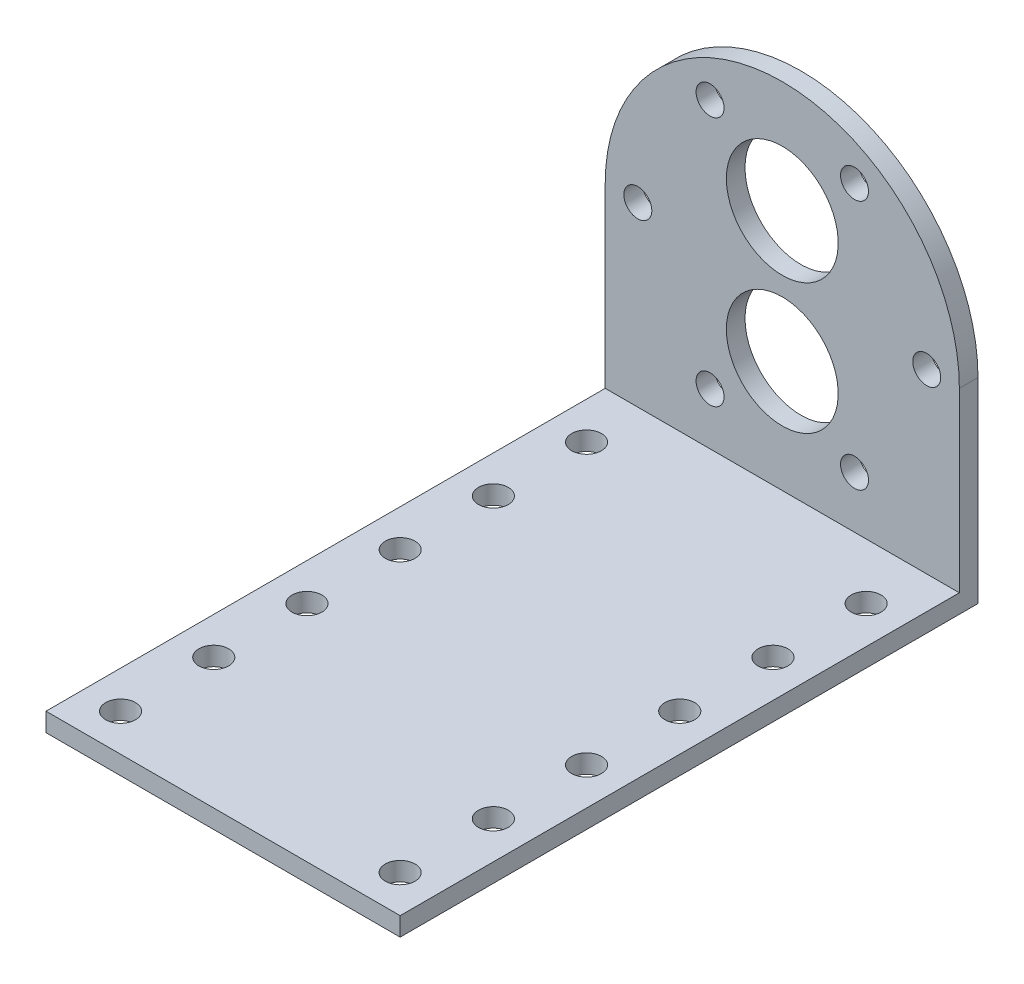
from build123d import *

# Parameters (mm, degrees)
EXTRUDE_1_DEPTH     = 2
SKETCH_2_W          = 38
SKETCH_2_H          = 2
EXTRUDE_2_DEPTH     = 60
SKETCH_3_R          = 1.6
CUT_EXTRUDE_1_DEPTH = 2
SKETCH_4_R          = 6
SKETCH_4_R_2        = 1.5
CUT_EXTRUDE_3_DEPTH = 2


with BuildPart() as part:
    # ｽｹｯﾁ1 → ﾎﾞｽ - 押し出し1 (new body)
    with BuildSketch(Plane.XY):
        with BuildLine():
            Line((-19, 0), (-19, -21))
            Line((-19, -21), (19, -21))
            Line((19, -21), (19, 0))
            ThreePointArc((19, 0), (0, 19), (-19, 0))
        make_face()
    extrude(amount=EXTRUDE_1_DEPTH)

    # ｽｹｯﾁ2 → ﾎﾞｽ - 押し出し2 (add)
    with BuildSketch(Plane.XY.offset(2)):
        with Locations((0, -20)):
            Rectangle(SKETCH_2_W, SKETCH_2_H)
    extrude(amount=EXTRUDE_2_DEPTH)

    # ｽｹｯﾁ3 → ｶｯﾄ - 押し出し1 (cut)
    with BuildSketch(Plane(origin=(0, -19, 0), x_dir=(1, 0, 0), z_dir=(0, 1, 0))):
        with Locations(Location((-15, -8, 0), (0, 0, 270))):
            Circle(SKETCH_3_R)
        with Locations(Location((-15, -18, 0), (0, 0, 270))):
            Circle(SKETCH_3_R)
        with Locations(Location((-15, -38, 0), (0, 0, 270))):
            Circle(SKETCH_3_R)
        with Locations(Location((-15, -28, 0), (0, 0, 270))):
            Circle(SKETCH_3_R)
        with Locations(Location((-15, -48, 0), (0, 0, 270))):
            Circle(SKETCH_3_R)
        with Locations(Location((15, -8, 0), (0, 0, 270))):
            Circle(SKETCH_3_R)
        with Locations(Location((15, -18, 0), (0, 0, 270))):
            Circle(SKETCH_3_R)
        with Locations(Location((15, -28, 0), (0, 0, 270))):
            Circle(SKETCH_3_R)
        with Locations(Location((15, -38, 0), (0, 0, 270))):
            Circle(SKETCH_3_R)
        with Locations(Location((15, -48, 0), (0, 0, 270))):
            Circle(SKETCH_3_R)
        with Locations(Location((-15, -58, 0), (0, 0, 270))):
            Circle(SKETCH_3_R)
        with Locations(Location((15, -58, 0), (0, 0, 270))):
            Circle(SKETCH_3_R)
    extrude(amount=-CUT_EXTRUDE_1_DEPTH, mode=Mode.SUBTRACT)

    # ｽｹｯﾁ4 → ｶｯﾄ - 押し出し3 (cut)
    with BuildSketch(Plane(origin=(0, 0, 0), x_dir=(-1, 0, 0), z_dir=(0, 0, -1))):
        with Locations((0, 7)):
            Circle(SKETCH_4_R)
        with Locations((0, -7)):
            Circle(SKETCH_4_R)
        with Locations((-7.75, 13.423393759)):
            Circle(SKETCH_4_R_2)
        with Locations((-15.5, 0)):
            Circle(SKETCH_4_R_2)
        with Locations((15.5, 0)):
            Circle(SKETCH_4_R_2)
        with Locations((7.75, 13.423393759)):
            Circle(SKETCH_4_R_2)
        with Locations((7.75, -13.423393759)):
            Circle(SKETCH_4_R_2)
        with Locations((-7.75, -13.423393759)):
            Circle(SKETCH_4_R_2)
    extrude(amount=-CUT_EXTRUDE_3_DEPTH, mode=Mode.SUBTRACT)


solid = part.part
